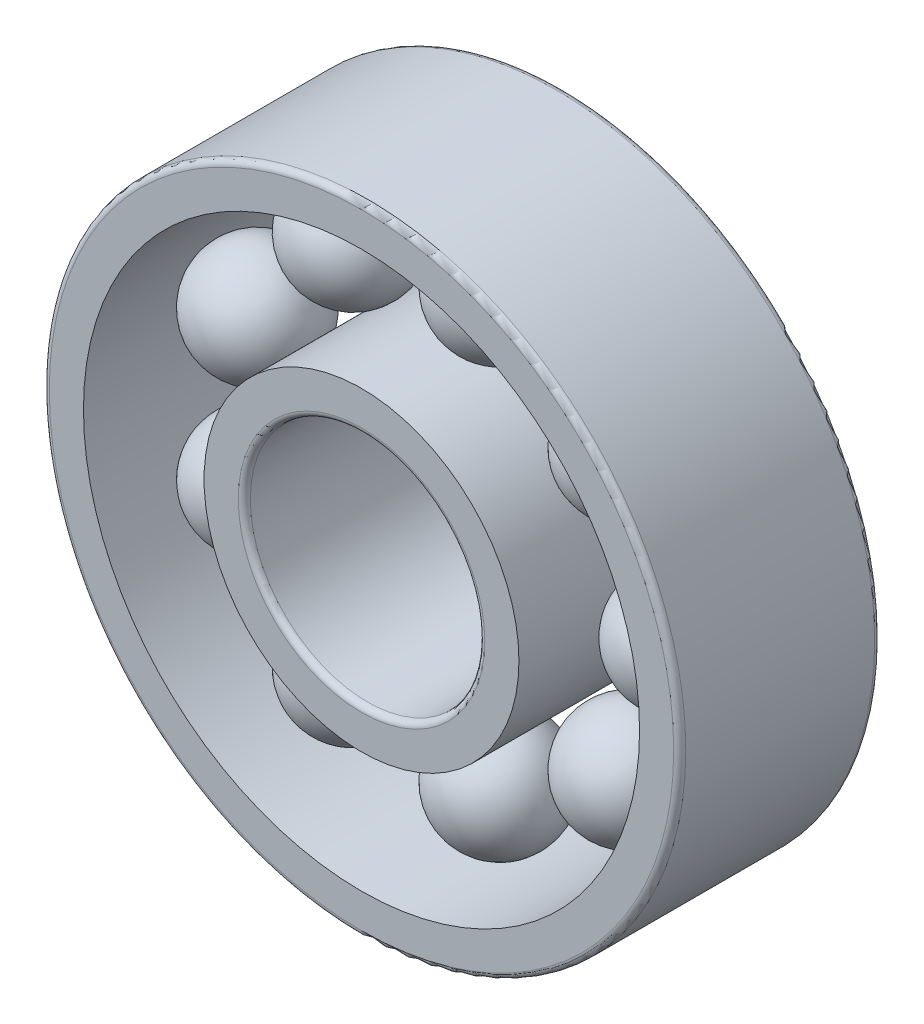
from build123d import *

# Parameters (mm, degrees)
INNERS_W           = 1.2
INNERS_H           = 6
OUTERS_W           = 1.2
OUTERS_H           = 6
BALLSPATTERN_COUNT = 9
FILLET_F1_R        = 0.18
FILLET_F2_R        = 0.18


with BuildPart() as part:
    # InnerS → InnerRing (revolve)
    with BuildSketch(Plane(origin=(0, 0, 0), x_dir=(1, 0, 0), z_dir=(0, 1, 0))):
        with Locations((4.1, 0)):
            Rectangle(INNERS_W, INNERS_H)
    revolve(axis=Axis((0, 0, 5.5), (0, 0, -1)))

    # Fillet F2
    fillet_f2_edges = [part.edges().sort_by_distance(p)[0] for p in [
        (-3.5, 0, -3),
        (-3.5, 0, 3),
    ]]
    fillet(fillet_f2_edges, radius=FILLET_F2_R)


with BuildPart() as body_2:
    # OuterS → OuterRing (revolve)
    with BuildSketch(Plane(origin=(0, 0, 0), x_dir=(1, 0, 0), z_dir=(0, 1, 0))):
        with Locations((8.9, 0)):
            Rectangle(OUTERS_W, OUTERS_H)
    revolve(axis=Axis((0, 0, 5.5), (0, 0, -1)))

    # Fillet F1
    fillet_f1_edges = [body_2.edges().sort_by_distance(p)[0] for p in [
        (-9.5, 0, -3),
        (-9.5, 0, 3),
    ]]
    fillet(fillet_f1_edges, radius=FILLET_F1_R)


with BuildPart() as body_3:
    # BallS → Ball (revolve)
    with BuildSketch(Plane(origin=(0, 0, 0), x_dir=(1, 0, 0), z_dir=(0, 1, 0))):
        with BuildLine():
            Line((4.79, 0), (8.21, 0))
            ThreePointArc((8.21, 0), (6.5, -1.71), (4.79, 0))
        make_face()
    revolve(axis=Axis((4.79, 0, 0), (1, 0, 0)))


with BuildPart() as ballspattern_1:
    # BallsPattern: pattern copy
    add(body_3.part.rotate(Axis((0, 0, -3.3), (0, 0, 1)), 1 * 360 / BALLSPATTERN_COUNT))


with BuildPart() as ballspattern_2:
    # BallsPattern: pattern copy
    add(body_3.part.rotate(Axis((0, 0, -3.3), (0, 0, 1)), 2 * 360 / BALLSPATTERN_COUNT))


with BuildPart() as ballspattern_3:
    # BallsPattern: pattern copy
    add(body_3.part.rotate(Axis((0, 0, -3.3), (0, 0, 1)), 3 * 360 / BALLSPATTERN_COUNT))


with BuildPart() as ballspattern_4:
    # BallsPattern: pattern copy
    add(body_3.part.rotate(Axis((0, 0, -3.3), (0, 0, 1)), 4 * 360 / BALLSPATTERN_COUNT))


with BuildPart() as ballspattern_5:
    # BallsPattern: pattern copy
    add(body_3.part.rotate(Axis((0, 0, -3.3), (0, 0, 1)), 5 * 360 / BALLSPATTERN_COUNT))


with BuildPart() as ballspattern_6:
    # BallsPattern: pattern copy
    add(body_3.part.rotate(Axis((0, 0, -3.3), (0, 0, 1)), 6 * 360 / BALLSPATTERN_COUNT))


with BuildPart() as ballspattern_7:
    # BallsPattern: pattern copy
    add(body_3.part.rotate(Axis((0, 0, -3.3), (0, 0, 1)), 7 * 360 / BALLSPATTERN_COUNT))


with BuildPart() as ballspattern_8:
    # BallsPattern: pattern copy
    add(body_3.part.rotate(Axis((0, 0, -3.3), (0, 0, 1)), 8 * 360 / BALLSPATTERN_COUNT))


solid = Compound([part.part, body_2.part, body_3.part, ballspattern_1.part, ballspattern_2.part, ballspattern_3.part, ballspattern_4.part, ballspattern_5.part, ballspattern_6.part, ballspattern_7.part, ballspattern_8.part])
